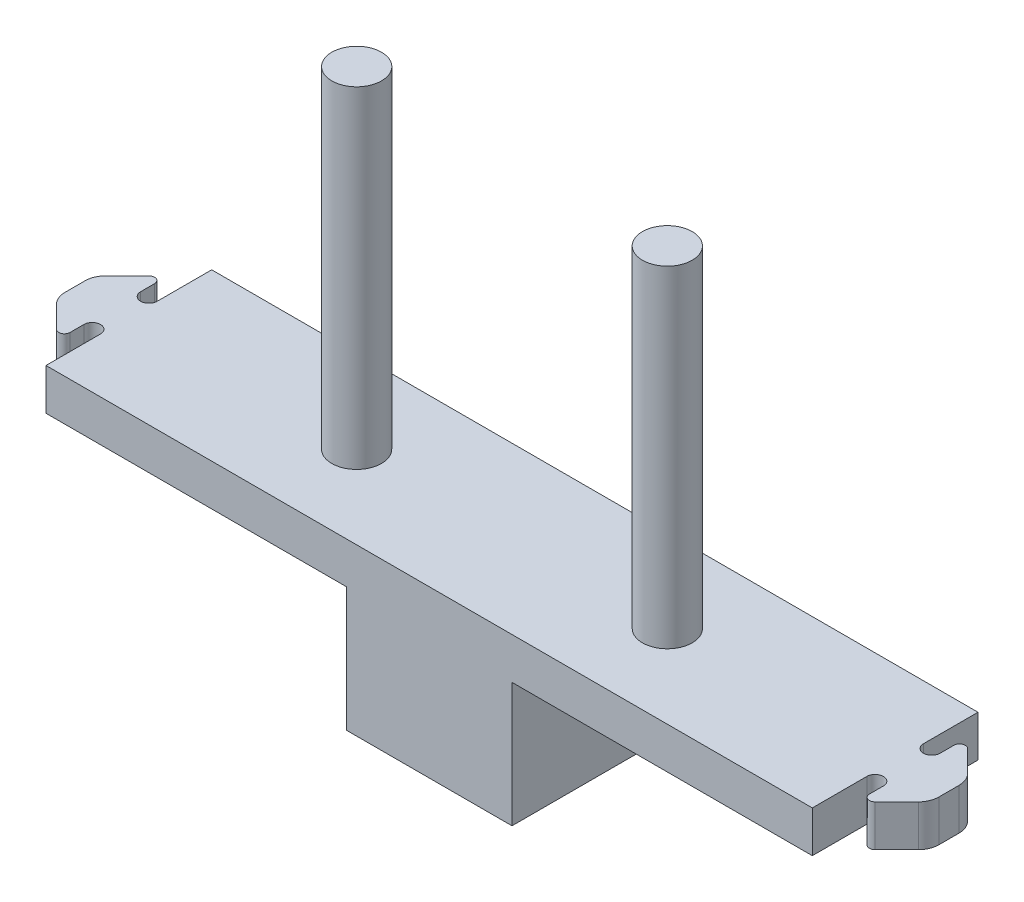
from build123d import *

# Parameters (mm, degrees)
SKETCH1_W           = 117.475
SKETCH1_H           = 25.4
BOSS_EXTRUDE1_DEPTH = 6.35
SKETCH3_R           = 3.81
BOSS_EXTRUDE2_DEPTH = 50.8
BOSS_EXTRUDE7_DEPTH = 6.35
SKETCH12_W          = 25.4
SKETCH12_H          = 25.4
BOSS_EXTRUDE8_DEPTH = 19.05


with BuildPart() as part:
    # Sketch1 → Boss-Extrude1 (new body)
    with BuildSketch(Plane(origin=(0, 0, 0), x_dir=(1, 0, 0), z_dir=(0, 1, 0))):
        with Locations((-58.7375, -12.7)):
            Rectangle(SKETCH1_W, SKETCH1_H)
    extrude(amount=BOSS_EXTRUDE1_DEPTH)

    # Sketch3 → Boss-Extrude2 (add)
    with BuildSketch(Plane(origin=(0, 6.35, 0), x_dir=(1, 0, 0), z_dir=(0, 1, 0))):
        with Locations(Location((-34.925, -12.7, 0), (0, 0, 90))):
            Circle(SKETCH3_R)
        with Locations(Location((-82.55, -12.7, 0), (0, 0, 90))):
            Circle(SKETCH3_R)
    extrude(amount=BOSS_EXTRUDE2_DEPTH)

    # Sketch10 → Boss-Extrude7 (add)
    with BuildSketch(Plane(origin=(0, 6.35, 0), x_dir=(1, 0, 0), z_dir=(0, 1, 0))):
        with BuildLine():
            Line((0, -12.7), (0, -8.3566))
            ThreePointArc((0, -8.3566), (1.27, -9.6266), (2.54, -8.3566))
            Line((2.54, -8.3566), (2.54, -6.223))
            ThreePointArc((2.54, -6.223), (3.073114588, -5.425137636), (4.014257416, -5.612342584))
            Line((4.014257416, -5.612342584), (7.336952181, -8.935037349))
            ThreePointArc((7.336952181, -8.935037349), (8.017998618, -9.969860776), (8.2511937, -11.186538149))
            Line((8.2511937, -11.186538149), (8.2511937, -12.7))
            Line((8.2511937, -12.7), (0, -12.7))
        make_face()
        with BuildLine():
            Line((-117.475, -12.7), (-117.475, -8.3566))
            ThreePointArc((-117.475, -8.3566), (-118.745, -9.6266), (-120.015, -8.3566))
            Line((-120.015, -8.3566), (-120.015, -6.223))
            ThreePointArc((-120.015, -6.223), (-120.548114588, -5.425137636), (-121.489257416, -5.612342584))
            Line((-121.489257416, -5.612342584), (-124.811952181, -8.935037349))
            ThreePointArc((-124.811952181, -8.935037349), (-125.492998618, -9.969860776), (-125.7261937, -11.186538149))
            Line((-125.7261937, -11.186538149), (-125.7261937, -12.7))
            Line((-125.7261937, -12.7), (-117.475, -12.7))
        make_face()
    boss_extrude7 = extrude(amount=-BOSS_EXTRUDE7_DEPTH)

    # Mirror1: Boss-Extrude7 across plane
    add(boss_extrude7.mirror(Plane(origin=(8.2511937, 0, 12.7), x_dir=(1, 0, 0), z_dir=(0, 0, 1))))

    # Sketch12 → Boss-Extrude8 (add)
    with BuildSketch(Plane(origin=(0, 0, 0), x_dir=(-1, 0, 0), z_dir=(0, -1, 0))):
        with Locations((58.7375, -12.7)):
            Rectangle(SKETCH12_W, SKETCH12_H)
    extrude(amount=BOSS_EXTRUDE8_DEPTH)


solid = part.part
